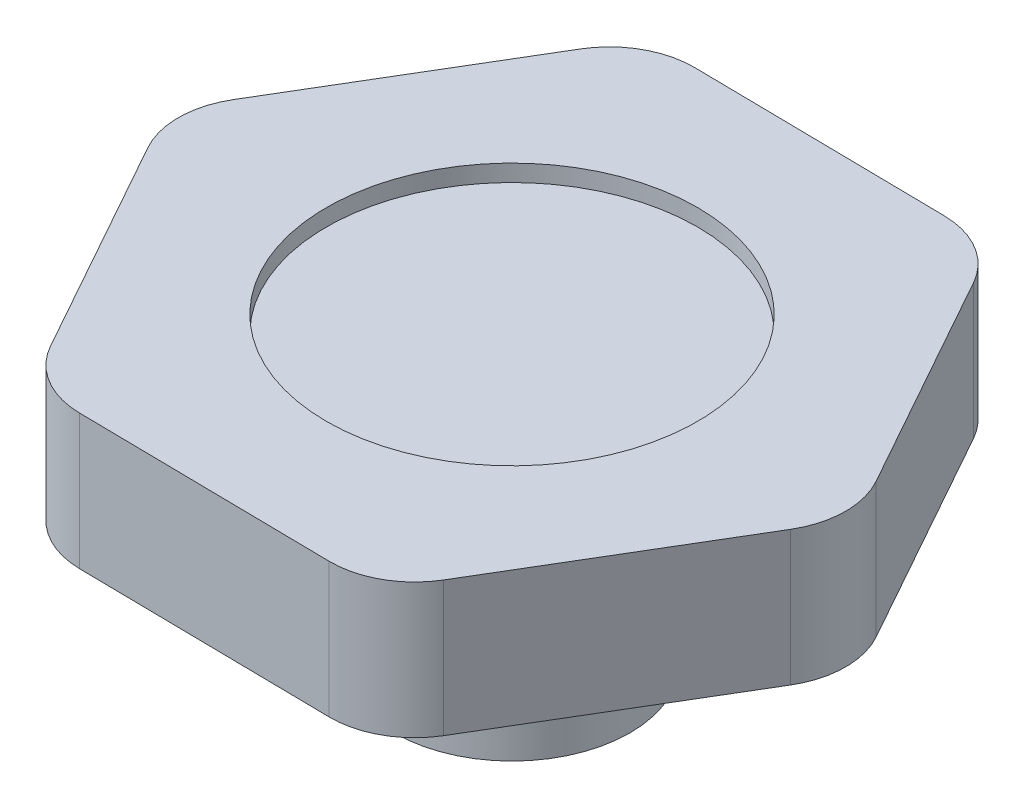
from build123d import *

# Parameters (mm, degrees)
SKETCH1_R           = 7
BOSS_EXTRUDE1_DEPTH = 10
CUT_EXTRUDE1_DEPTH  = 5
BOSS_EXTRUDE2_DEPTH = 8
FILLET1_R           = 5
SKETCH4_R           = 11
CUT_EXTRUDE2_DEPTH  = 1


with BuildPart() as part:
    # Sketch1 → Boss-Extrude1 (new body)
    with BuildSketch(Plane(origin=(0, 0, 0), x_dir=(1, 0, 0), z_dir=(0, 1, 0))):
        with Locations(Location((0, 0, 0), (0, 0, 270))):
            Circle(SKETCH1_R)
    extrude(amount=BOSS_EXTRUDE1_DEPTH)

    # Sketch2 → Cut-Extrude1 (cut)
    with BuildSketch(Plane.XZ):
        Polygon((4.76388744, -2.718218128), (4.735989672, 2.76653848), (-0.027897769, 5.484756608), (-4.76388744, 2.718218128), (-4.735989672, -2.76653848), (0.027897769, -5.484756608), align=None)
    extrude(amount=-CUT_EXTRUDE1_DEPTH, mode=Mode.SUBTRACT)

    # Sketch3 → Boss-Extrude2 (add)
    with BuildSketch(Plane(origin=(0, 10, 0), x_dir=(1, 0, 0), z_dir=(0, 1, 0))):
        Polygon((20.782516215, -0.294991143), (10.646727931, 17.850691425), (-10.135788284, 18.145682568), (-20.782516215, 0.294991143), (-10.646727931, -17.850691425), (10.135788284, -18.145682568), align=None)
    extrude(amount=BOSS_EXTRUDE2_DEPTH)

    # Fillet1
    fillet1_edges = [part.edges().sort_by_distance(p)[0] for p in [
        (10.135788284, 14, 18.145682568),
        (20.782516215, 14, 0.294991143),
        (10.646727931, 14, -17.850691425),
        (-10.135788284, 14, -18.145682568),
        (-20.782516215, 14, -0.294991143),
        (-10.646727931, 14, 17.850691425),
    ]]
    fillet(fillet1_edges, radius=FILLET1_R)

    # Sketch4 → Cut-Extrude2 (cut)
    with BuildSketch(Plane(origin=(0, 18, 0), x_dir=(1, 0, 0), z_dir=(0, 1, 0))):
        with Locations(Location((0, 0, 0), (0, 0, 270))):
            Circle(SKETCH4_R)
    extrude(amount=-CUT_EXTRUDE2_DEPTH, mode=Mode.SUBTRACT)


solid = part.part
